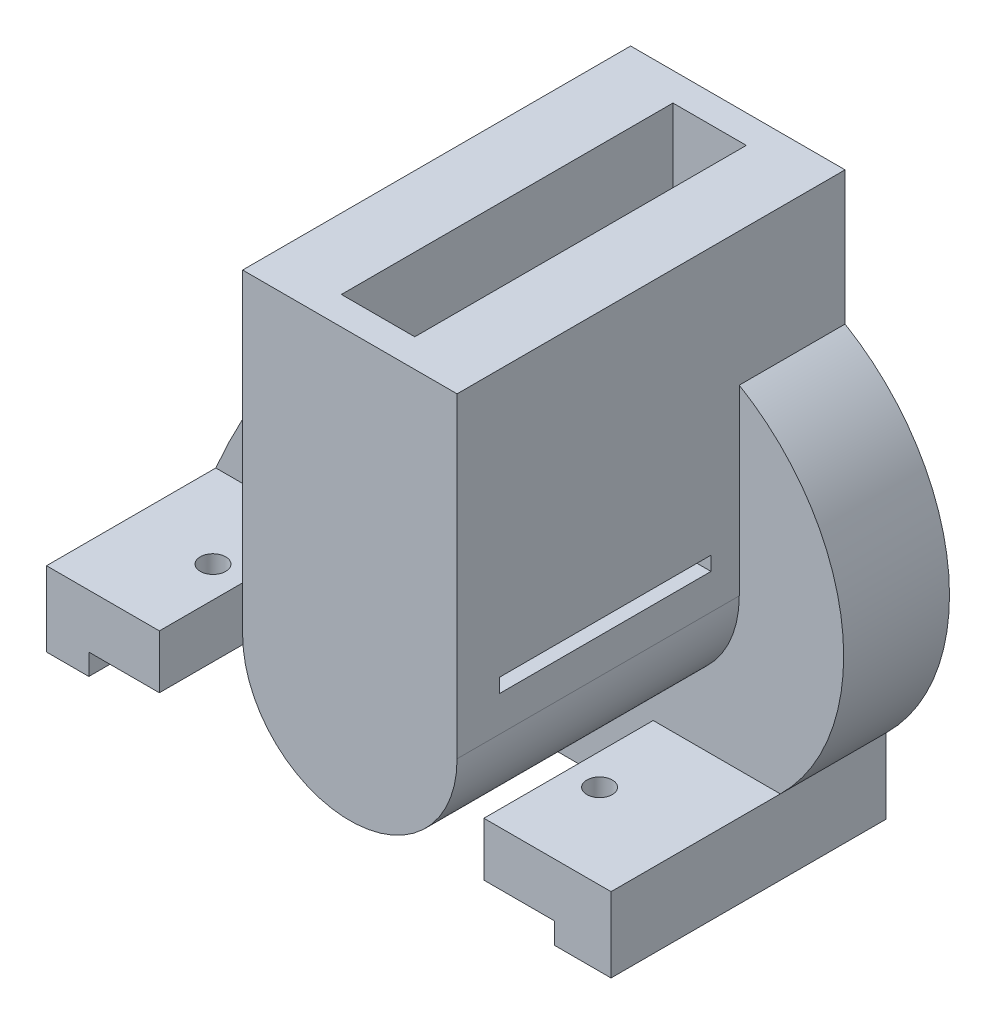
from build123d import *

# Parameters (mm, degrees)
SALIENTE_EXTRUIR1_DEPTH = 23.5
CORTAR_EXTRUIR1_START   = -18
CORTAR_EXTRUIR1_DEPTH   = 18
SALIENTE_EXTRUIR2_START = 2
SALIENTE_EXTRUIR2_DEPTH = 2
SALIENTE_EXTRUIR3_DEPTH = 2
CROQUIS7_W              = 15
CROQUIS7_H              = 1
CORTAR_EXTRUIR2_DEPTH   = 41.777076894
SALIENTE_EXTRUIR4_DEPTH = 12
SALIENTE_EXTRUIR5_DEPTH = 7.5
CROQUIS12_R             = 3.65
CORTAR_EXTRUIR3_DEPTH   = 2
CROQUIS13_R             = 0.9
CORTAR_EXTRUIR4_DEPTH   = 3.8


with BuildPart() as part:
    # Croquis1 → Saliente-Extruir1 (new body)
    with BuildSketch(Plane.XY):
        with BuildLine():
            Line((-7.6, 12.932130528), (-7.6, 22.4))
            Line((-7.6, 22.4), (-2.6, 22.4))
            Line((-2.6, 22.4), (-2.6, 0))
            ThreePointArc((-2.6, 0), (0, -2.6), (2.6, 0))
            Line((2.6, 0), (2.6, 22.4))
            Line((2.6, 22.4), (7.6, 22.4))
            Line((7.6, 22.4), (7.6, 12.932130528))
            ThreePointArc((7.6, 12.932130528), (0, -15), (-7.6, 12.932130528))
        make_face()
    extrude(amount=SALIENTE_EXTRUIR1_DEPTH)

    # Croquis2 → Cortar-Extruir1 (cut)
    with BuildSketch(Plane.XY.offset(23.5).offset(CORTAR_EXTRUIR1_START)):
        with BuildLine():
            Line((-7.6, 12.932130528), (-7.6, 0))
            ThreePointArc((-7.6, 0), (0, -7.6), (7.6, 0))
            Line((7.6, 0), (7.6, 12.932130528))
            ThreePointArc((7.6, 12.932130528), (0, -15), (-7.6, 12.932130528))
        make_face()
    extrude(amount=CORTAR_EXTRUIR1_DEPTH, mode=Mode.SUBTRACT)

    # Croquis4 → Saliente-Extruir2 (add)
    with BuildSketch(Plane(origin=(0, 0, 0), x_dir=(-1, 0, 0), z_dir=(0, 0, -1)).offset(SALIENTE_EXTRUIR2_START)):
        with BuildLine():
            Line((-2.6, 0), (-2.6, 14.77294825))
            ThreePointArc((-2.6, 14.77294825), (-5.182388684, 14.07632223), (-7.6, 12.932130528))
            ThreePointArc((-7.6, 12.932130528), (-7.449832213, -13.019216566), (15, 0))
            ThreePointArc((15, 0), (13.019216566, 7.449832213), (7.6, 12.932130528))
            ThreePointArc((7.6, 12.932130528), (5.182388684, 14.07632223), (2.6, 14.77294825))
            Line((2.6, 14.77294825), (2.6, 0))
            ThreePointArc((2.6, 0), (0, -2.6), (-2.6, 0))
        make_face()
        with BuildLine():
            Line((-2.6, 0), (-2.6, 14.77294825))
            ThreePointArc((-2.6, 14.77294825), (-5.182388684, 14.07632223), (-7.6, 12.932130528))
            ThreePointArc((-7.6, 12.932130528), (-7.449832213, -13.019216566), (15, 0))
            ThreePointArc((15, 0), (13.019216566, 7.449832213), (7.6, 12.932130528))
            ThreePointArc((7.6, 12.932130528), (5.182388684, 14.07632223), (2.6, 14.77294825))
            Line((2.6, 14.77294825), (2.6, 0))
            ThreePointArc((2.6, 0), (0, -2.6), (-2.6, 0))
        make_face()
        with BuildLine():
            ThreePointArc((2.6, 14.77294825), (0, 15), (-2.6, 14.77294825))
            Line((-2.6, 14.77294825), (-2.6, 0))
            ThreePointArc((-2.6, 0), (0, 2.6), (2.6, 0))
            Line((2.6, 0), (2.6, 14.77294825))
        make_face()
        with BuildLine():
            Line((7.6, 22.4), (2.6, 22.4))
            Line((2.6, 22.4), (2.6, 14.77294825))
            ThreePointArc((2.6, 14.77294825), (5.182388684, 14.07632223), (7.6, 12.932130528))
            Line((7.6, 12.932130528), (7.6, 22.4))
        make_face()
        with BuildLine():
            Line((2.6, 22.4), (-2.6, 22.4))
            Line((-2.6, 22.4), (-2.6, 14.77294825))
            ThreePointArc((-2.6, 14.77294825), (0, 15), (2.6, 14.77294825))
            Line((2.6, 14.77294825), (2.6, 22.4))
        make_face()
        with BuildLine():
            Line((-2.6, 14.77294825), (-2.6, 22.4))
            Line((-2.6, 22.4), (-7.6, 22.4))
            Line((-7.6, 22.4), (-7.6, 12.932130528))
            ThreePointArc((-7.6, 12.932130528), (-5.182388684, 14.07632223), (-2.6, 14.77294825))
        make_face()
    extrude(amount=-SALIENTE_EXTRUIR2_DEPTH)

    # Croquis6 → Saliente-Extruir3 (add)
    with BuildSketch(Plane.XY.offset(23.5)):
        with BuildLine():
            Line((-2.6, 22.4), (2.6, 22.4))
            Line((2.6, 22.4), (7.6, 22.4))
            Line((7.6, 22.4), (7.6, 0))
            ThreePointArc((7.6, 0), (0, -7.6), (-7.6, 0))
            Line((-7.6, 0), (-7.6, 22.4))
            Line((-7.6, 22.4), (-2.6, 22.4))
        make_face()
    extrude(amount=SALIENTE_EXTRUIR3_DEPTH)

    # Croquis7 → Cortar-Extruir2 (cut, through all)
    with BuildSketch(Plane.ZY.offset(7.6)):
        with Locations((15, 3)):
            Rectangle(CROQUIS7_W, CROQUIS7_H)
    extrude(amount=-CORTAR_EXTRUIR2_DEPTH, mode=Mode.SUBTRACT)

    # Croquis8 → Saliente-Extruir4 (add)
    with BuildSketch(Plane.XY.offset(5.5)):
        Polygon((-21.5, -14.5), (-21.5, -10.7), (-29.5, -10.7), (-29.5, -16), (-26.5, -16), (-26.5, -14.5), align=None)
        Polygon((6.5, -16), (6.5, -14.5), (1.5, -14.5), (1.5, -10.7), (10.512373662, -10.7), (10.512373662, -16), align=None)
    extrude(amount=SALIENTE_EXTRUIR4_DEPTH)


with BuildPart() as saliente_extruir4_piece_1:
    # of the separate pieces the step leaves, piece 1, a body of its own (saliente_extruir4_pieces)
    add(part.part.solids().sort_by_distance((-7.6, 12.932130528, 5.5))[0])

    # Croquis10 → Saliente-Extruir5 (add)
    with BuildSketch(Plane(origin=(0, 0, -2), x_dir=(-1, 0, 0), z_dir=(0, 0, -1))):
        with BuildLine():
            ThreePointArc((29.5, -10.7), (20.603060039, 3.018645093), (7.6, 12.932130528))
            ThreePointArc((7.6, 12.932130528), (11.905455825, -9.124698438), (-10.512373662, -10.7))
            Line((-10.512373662, -10.7), (-10.512373662, -16))
            Line((-10.512373662, -16), (29.5, -16))
            Line((29.5, -16), (29.5, -10.7))
        make_face()
    extrude(amount=-SALIENTE_EXTRUIR5_DEPTH)

    # Croquis12 → Cortar-Extruir3 (cut)
    with BuildSketch(Plane(origin=(0, 0, -2), x_dir=(-1, 0, 0), z_dir=(0, 0, -1))):
        Circle(CROQUIS12_R)
    extrude(amount=-CORTAR_EXTRUIR3_DEPTH, mode=Mode.SUBTRACT)


with BuildPart() as saliente_extruir4_piece_2:
    # of the separate pieces the step leaves, piece 2, a body of its own (saliente_extruir4_pieces)
    add(part.part.solids().sort_by_distance((-21.5, -14.5, 5.5))[0])


with BuildPart() as cortar_extruir4_tool:
    # Croquis13 → Cortar-Extruir4 (new body)
    with BuildSketch(Plane.XZ.offset(14.5)):
        with Locations(Location((-23.7, 11.5, 0), (0, 0, 270))):
            Circle(CROQUIS13_R)
        with Locations(Location((3.7, 11.5, 0), (0, 0, 270))):
            Circle(CROQUIS13_R)
    extrude(amount=-CORTAR_EXTRUIR4_DEPTH)


with BuildPart() as saliente_extruir4_piece_1_1:
    add(saliente_extruir4_piece_1.part)

    # Cortar-Extruir4: cut by cortar_extruir4_tool
    add(cortar_extruir4_tool.part, mode=Mode.SUBTRACT)


with BuildPart() as saliente_extruir4_piece_2_1:
    add(saliente_extruir4_piece_2.part)

    # Cortar-Extruir4: cut by cortar_extruir4_tool
    add(cortar_extruir4_tool.part, mode=Mode.SUBTRACT)


solid = Compound([saliente_extruir4_piece_1_1.part, saliente_extruir4_piece_2_1.part])
